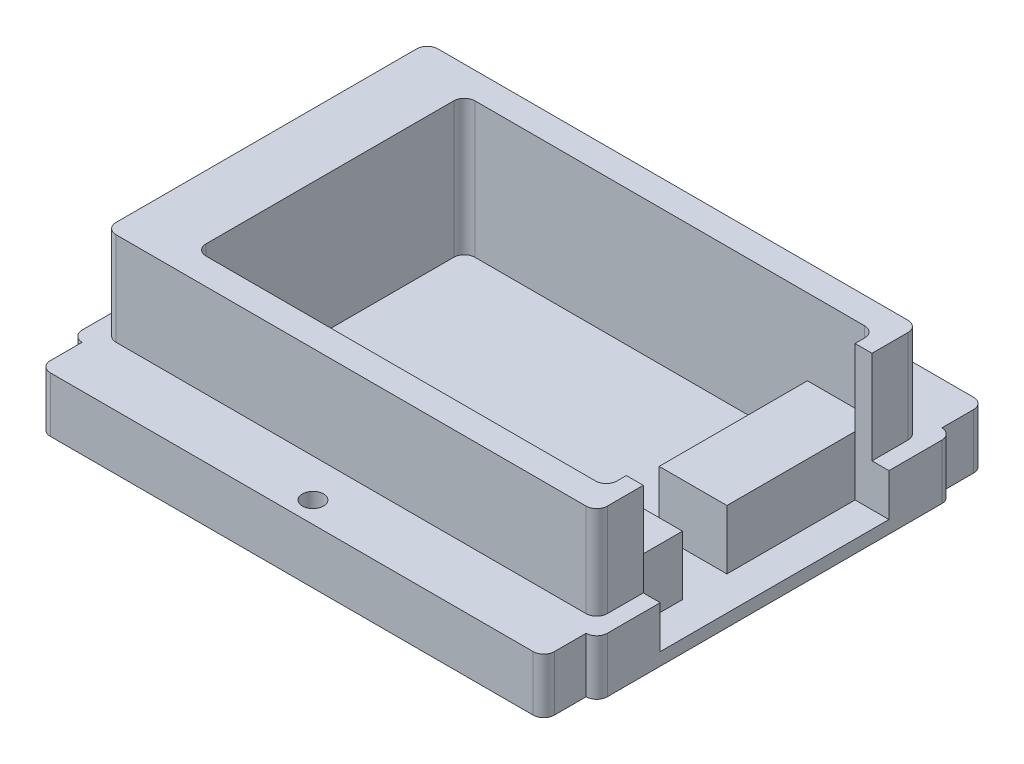
from build123d import *

# Parameters (mm, degrees)
SKETCH1_W           = 124
SKETCH1_H           = 84
BOSS_EXTRUDE1_DEPTH = 35
SKETCH2_W           = 97
SKETCH2_H           = 63.5
CUT_EXTRUDE1_DEPTH  = 32
SKETCH4_W           = 8
SKETCH4_H           = 54
CUT_EXTRUDE2_DEPTH  = 32
FILLET2_R           = 2.5
CUT_EXTRUDE3_DEPTH  = 22
FILLET4_R           = 2.5
SKETCH9_W           = 119
SKETCH9_H           = 13
BOSS_EXTRUDE3_DEPTH = 10
SKETCH11_W          = 119
SKETCH11_H          = 13
BOSS_EXTRUDE4_DEPTH = 10
SKETCH12_R          = 2.5
CUT_EXTRUDE6_DEPTH  = 84.857021173
FILLET5_R           = 2.5
BOSS_EXTRUDE5_DEPTH = 14


with BuildPart() as part:
    # Sketch1 → Boss-Extrude1 (new body)
    with BuildSketch(Plane(origin=(0, 0, 0), x_dir=(1, 0, 0), z_dir=(0, 1, 0))):
        Rectangle(SKETCH1_W, SKETCH1_H)
    extrude(amount=BOSS_EXTRUDE1_DEPTH)

    # Sketch2 → Cut-Extrude1 (cut)
    with BuildSketch(Plane(origin=(0, 35, 0), x_dir=(1, 0, 0), z_dir=(0, 1, 0))):
        with Locations((5.5, 0)):
            Rectangle(SKETCH2_W, SKETCH2_H)
    extrude(amount=-CUT_EXTRUDE1_DEPTH, mode=Mode.SUBTRACT)

    # Sketch4 → Cut-Extrude2 (cut)
    with BuildSketch(Plane(origin=(0, 35, 0), x_dir=(1, 0, 0), z_dir=(0, 1, 0))):
        with Locations((58, 0)):
            Rectangle(SKETCH4_W, SKETCH4_H)
    extrude(amount=-CUT_EXTRUDE2_DEPTH, mode=Mode.SUBTRACT)

    # Fillet2
    fillet2_edges = [part.edges().sort_by_distance(p)[0] for p in [
        (-43, 19, 31.75),
        (-43, 19, -31.75),
        (54, 19, -31.75),
        (54, 19, 31.75),
    ]]
    fillet(fillet2_edges, radius=FILLET2_R)

    # Sketch6 → Cut-Extrude3 (cut)
    with BuildSketch(Plane(origin=(0, 35, 0), x_dir=(1, 0, 0), z_dir=(0, 1, 0))):
        Polygon((-62, 42), (62, 42), (62, 27), (58, 27), (58, 38), (-58, 38), (-58, -38), (58, -38), (58, -27), (62, -27), (62, -42), (-62, -42), align=None)
    extrude(amount=-CUT_EXTRUDE3_DEPTH, mode=Mode.SUBTRACT)

    # Fillet4
    fillet4_edges = [part.edges().sort_by_distance(p)[0] for p in [
        (62, 6.5, 42),
        (-62, 6.5, 42),
        (-62, 6.5, -42),
        (62, 6.5, -42),
        (58, 24, -38),
        (-58, 24, -38),
        (-58, 24, 38),
        (58, 24, 38),
    ]]
    fillet(fillet4_edges, radius=FILLET4_R)

    # Sketch9 → Boss-Extrude3 (add)
    with BuildSketch(Plane(origin=(0, 0, -42), x_dir=(-1, 0, 0), z_dir=(0, 0, -1))):
        with Locations((0, 6.5)):
            Rectangle(SKETCH9_W, SKETCH9_H)
    extrude(amount=BOSS_EXTRUDE3_DEPTH)

    # Sketch11 → Boss-Extrude4 (add)
    with BuildSketch(Plane.XY.offset(42)):
        with Locations((0, 6.5)):
            Rectangle(SKETCH11_W, SKETCH11_H)
    extrude(amount=BOSS_EXTRUDE4_DEPTH)

    # Sketch12 → Cut-Extrude6 (cut, through all)
    with BuildSketch(Plane(origin=(0, 13, 0), x_dir=(1, 0, 0), z_dir=(0, 1, 0))):
        with Locations(Location((0, 47, 0), (0, 0, 270))):
            Circle(SKETCH12_R)
        with Locations(Location((0, -47, 0), (0, 0, 270))):
            Circle(SKETCH12_R)
    extrude(amount=-CUT_EXTRUDE6_DEPTH, mode=Mode.SUBTRACT)

    # Fillet5
    fillet5_edges = [part.edges().sort_by_distance(p)[0] for p in [
        (59.5, 6.5, -52),
        (-59.5, 6.5, -52),
        (-59.5, 6.5, 52),
        (59.5, 6.5, 52),
    ]]
    fillet(fillet5_edges, radius=FILLET5_R)

    # Sketch13 → Boss-Extrude5 (add)
    with BuildSketch(Plane(origin=(0, 3, 0), x_dir=(1, 0, 0), z_dir=(0, 1, 0))):
        with BuildLine():
            Line((38, 31.75), (38, -3.25))
            Line((38, -3.25), (54, -3.25))
            Line((54, -3.25), (54, 27))
            Line((54, 27), (54, 29.25))
            ThreePointArc((54, 29.25), (53.267766953, 31.017766953), (51.5, 31.75))
            Line((51.5, 31.75), (38, 31.75))
        make_face()
        with BuildLine():
            Line((38, -31.75), (38, -13.75))
            Line((38, -13.75), (54, -13.75))
            Line((54, -13.75), (54, -27))
            Line((54, -27), (54, -29.25))
            ThreePointArc((54, -29.25), (53.267766953, -31.017766953), (51.5, -31.75))
            Line((51.5, -31.75), (38, -31.75))
        make_face()
    extrude(amount=BOSS_EXTRUDE5_DEPTH)


solid = part.part
